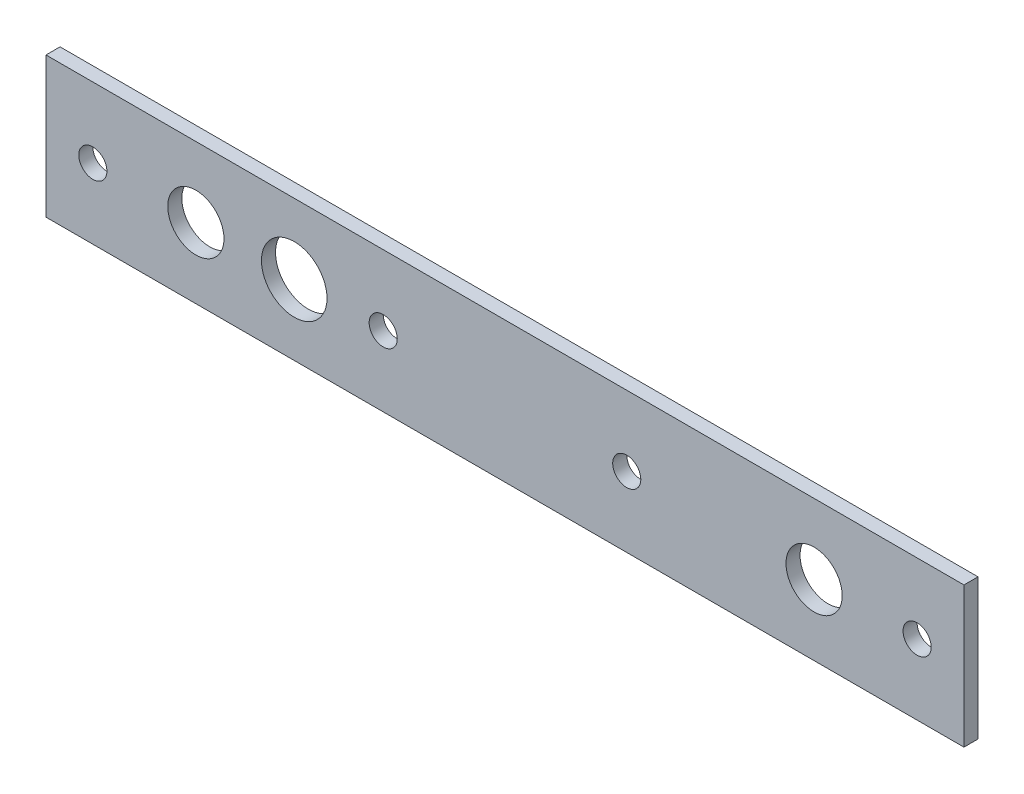
from build123d import *

# Parameters (mm, degrees)
ESQUISSE1_W      = 98
ESQUISSE1_H      = 15
ESQUISSE1_R      = 1.5
ESQUISSE1_R_2    = 3
ESQUISSE1_R_3    = 3.5
EXTRUSION1_DEPTH = 1.5


with BuildPart() as part:
    # Esquisse1 → Extrusion1 (new body)
    with BuildSketch(Plane.XY):
        with Locations((4.183103094, -14.318105263)):
            Rectangle(ESQUISSE1_W, ESQUISSE1_H)
        with Locations((-8.816896906, -14.318105263)):
            Circle(ESQUISSE1_R, mode=Mode.SUBTRACT)
        with Locations((17.183103094, -14.318105263)):
            Circle(ESQUISSE1_R, mode=Mode.SUBTRACT)
        with Locations((-28.816896906, -14.318105263)):
            Circle(ESQUISSE1_R_2, mode=Mode.SUBTRACT)
        with Locations((37.183103094, -14.318105263)):
            Circle(ESQUISSE1_R_2, mode=Mode.SUBTRACT)
        with Locations((-18.316896906, -14.318105263)):
            Circle(ESQUISSE1_R_3, mode=Mode.SUBTRACT)
        with Locations((48.183103094, -14.318105263)):
            Circle(ESQUISSE1_R, mode=Mode.SUBTRACT)
        with Locations((-39.816896906, -14.318105263)):
            Circle(ESQUISSE1_R, mode=Mode.SUBTRACT)
    extrude(amount=EXTRUSION1_DEPTH)


solid = part.part
